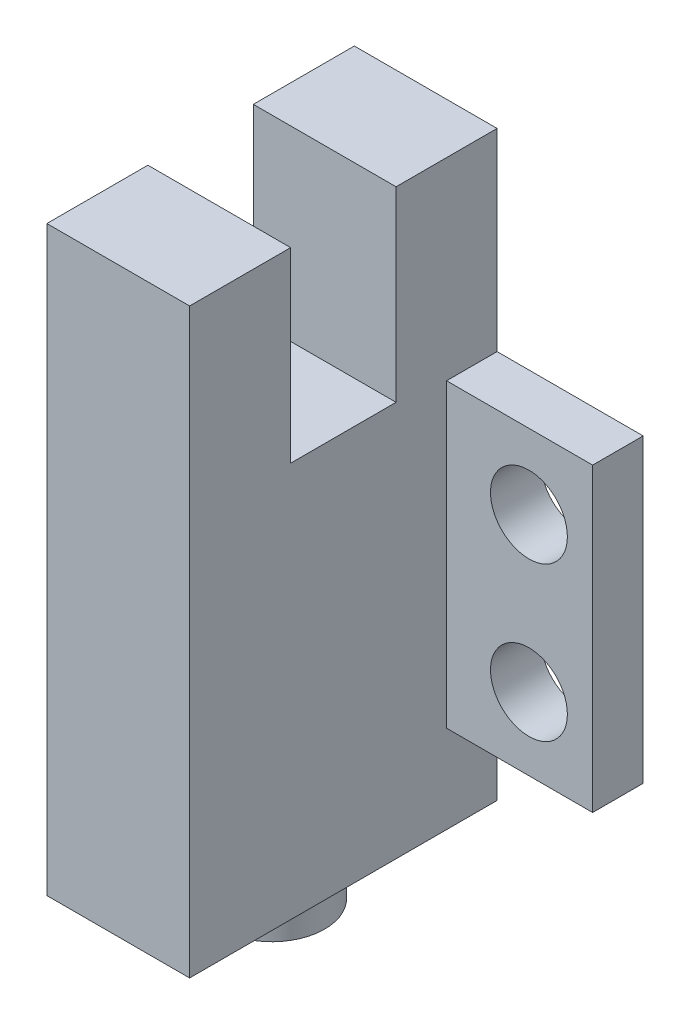
from build123d import *

# Parameters (mm, degrees)
SKETCH_1_W          = 6.5
SKETCH_1_H          = 14
EXTRUDE_1_DEPTH     = 26.5
SKETCH_2_W          = 6.5
SKETCH_2_H          = 4.8
CUT_EXTRUDE_1_DEPTH = 8.5
SKETCH_3_W          = 2.3
SKETCH_3_H          = 13.7
EXTRUDE_2_DEPTH     = 6.65
SKETCH_4_R          = 1.75
CUT_EXTRUDE_2_DEPTH = 6.65
SKETCH_5_R          = 2.4
EXTRUDE_3_DEPTH     = 2


with BuildPart() as part:
    # 草图1 → 凸台-拉伸1 (new body)
    with BuildSketch(Plane(origin=(0, 0, 0), x_dir=(1, 0, 0), z_dir=(0, 1, 0))):
        with Locations((3.25, 7)):
            Rectangle(SKETCH_1_W, SKETCH_1_H)
    extrude(amount=EXTRUDE_1_DEPTH)

    # 草图2 → 切除-拉伸1 (cut)
    with BuildSketch(Plane(origin=(0, 26.5, 0), x_dir=(1, 0, 0), z_dir=(0, 1, 0))):
        with Locations((3.25, 7)):
            Rectangle(SKETCH_2_W, SKETCH_2_H)
    extrude(amount=-CUT_EXTRUDE_1_DEPTH, mode=Mode.SUBTRACT)

    # 草图3 → 凸台-拉伸2 (add)
    with BuildSketch(Plane(origin=(6.5, 0, 0), x_dir=(0, 0, -1), z_dir=(1, 0, 0))):
        with Locations((12.85, 10.85)):
            Rectangle(SKETCH_3_W, SKETCH_3_H)
    extrude(amount=EXTRUDE_2_DEPTH)

    # 草图4 → 切除-拉伸2 (cut)
    with BuildSketch(Plane.XY.offset(-11.7)):
        with Locations((10.25, 14.3)):
            Circle(SKETCH_4_R)
        with Locations((10.25, 7.3)):
            Circle(SKETCH_4_R)
    extrude(amount=-CUT_EXTRUDE_2_DEPTH, mode=Mode.SUBTRACT)

    # 草图5 → 凸台-拉伸3 (add)
    with BuildSketch(Plane.XZ):
        with Locations(Location((3.25, -7, 0), (0, 0, 270))):
            Circle(SKETCH_5_R)
    extrude(amount=EXTRUDE_3_DEPTH)


solid = part.part
